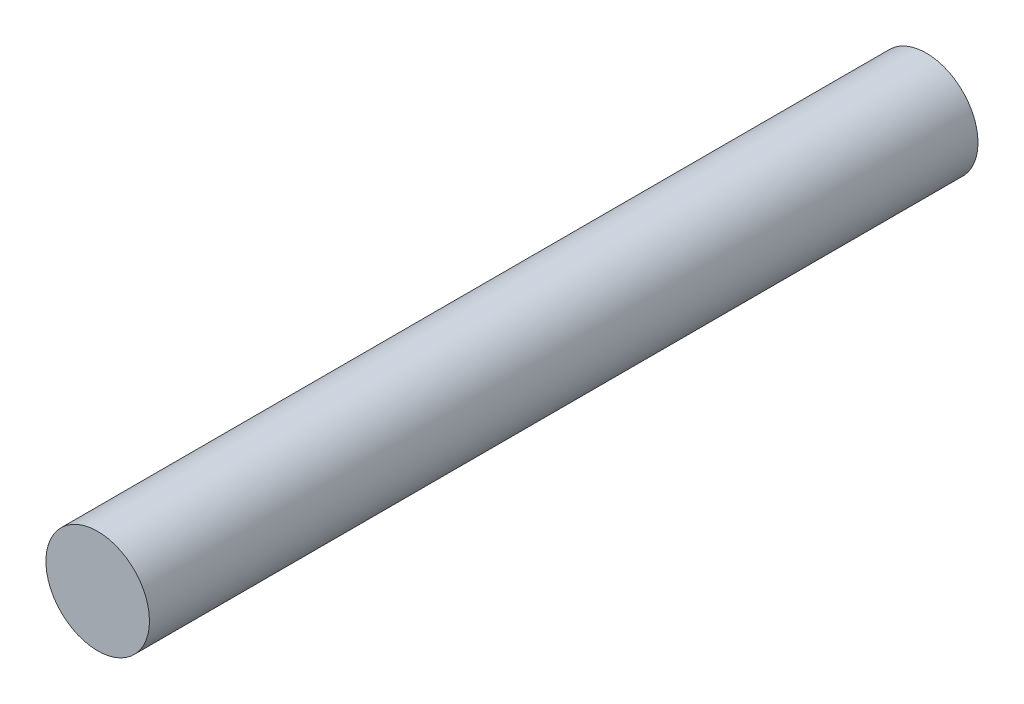
from build123d import *

# Parameters (mm, degrees)
SKETCH2_R           = 3.175
BOSS_EXTRUDE1_DEPTH = 50.8


with BuildPart() as part:
    # Sketch2 → Boss-Extrude1 (new body)
    with BuildSketch(Plane.XY):
        Circle(SKETCH2_R)
    extrude(amount=BOSS_EXTRUDE1_DEPTH)


solid = part.part
